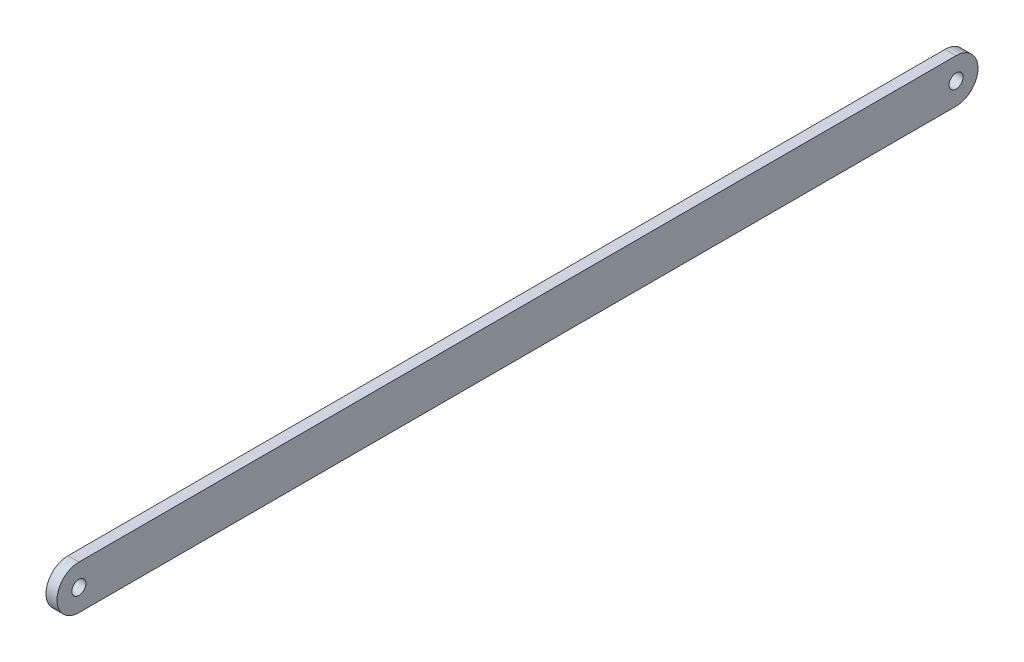
from build123d import *

# Parameters (mm, degrees)
SKETCH1_R           = 2.032
BOSS_EXTRUDE1_DEPTH = 3.175


with BuildPart() as part:
    # Sketch1 → Boss-Extrude1 (new body)
    with BuildSketch(Plane(origin=(0, 0, 0), x_dir=(0, 0, -1), z_dir=(1, 0, 0))):
        with BuildLine():
            Line((0, -6.35), (-254, -6.35))
            ThreePointArc((-254, -6.35), (-260.35, 0), (-254, 6.35))
            Line((-254, 6.35), (0, 6.35))
            ThreePointArc((0, 6.35), (6.35, 0), (0, -6.35))
        make_face()
        with Locations((-254, 0)):
            Circle(SKETCH1_R, mode=Mode.SUBTRACT)
        Circle(SKETCH1_R, mode=Mode.SUBTRACT)
    extrude(amount=BOSS_EXTRUDE1_DEPTH)


solid = part.part
